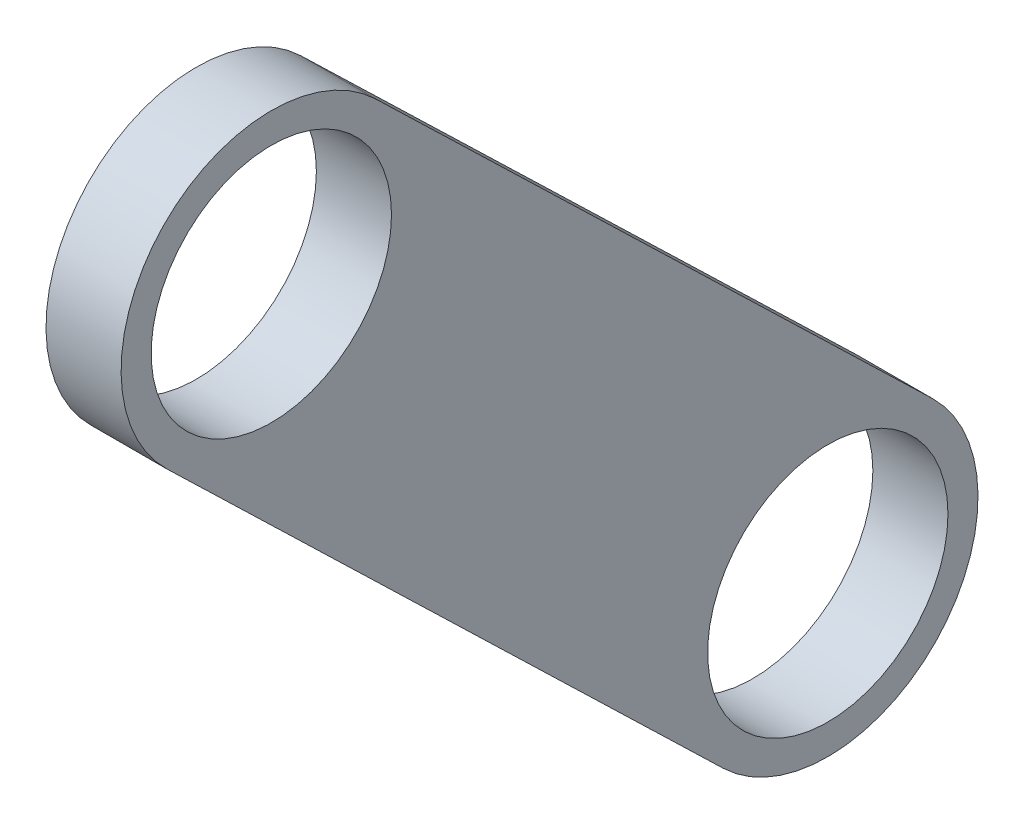
from build123d import *

# Parameters (mm, degrees)
BOSS_EXTRUDE1_START = -4
SKETCH2_R           = 8
BOSS_EXTRUDE1_DEPTH = 5


with BuildPart() as part:
    # Sketch2 → Boss-Extrude1 (new body)
    with BuildSketch(Plane(origin=(0, 0, 0), x_dir=(0, 0, -1), z_dir=(1, 0, 0)).offset(BOSS_EXTRUDE1_START)):
        with BuildLine():
            Line((43.989770311, -28.585837543), (6.947291622, 7.192714309))
            ThreePointArc((6.947291622, 7.192714309), (-7.192714309, 6.947291622), (-6.947291622, -7.192714309))
            Line((-6.947291622, -7.192714309), (30.095187067, -42.97126616))
            ThreePointArc((30.095187067, -42.97126616), (44.235192998, -42.725843473), (43.989770311, -28.585837543))
        make_face()
        with Locations((37.042478689, -35.778551851)):
            Circle(SKETCH2_R, mode=Mode.SUBTRACT)
        Circle(SKETCH2_R, mode=Mode.SUBTRACT)
    extrude(amount=-BOSS_EXTRUDE1_DEPTH)


solid = part.part
